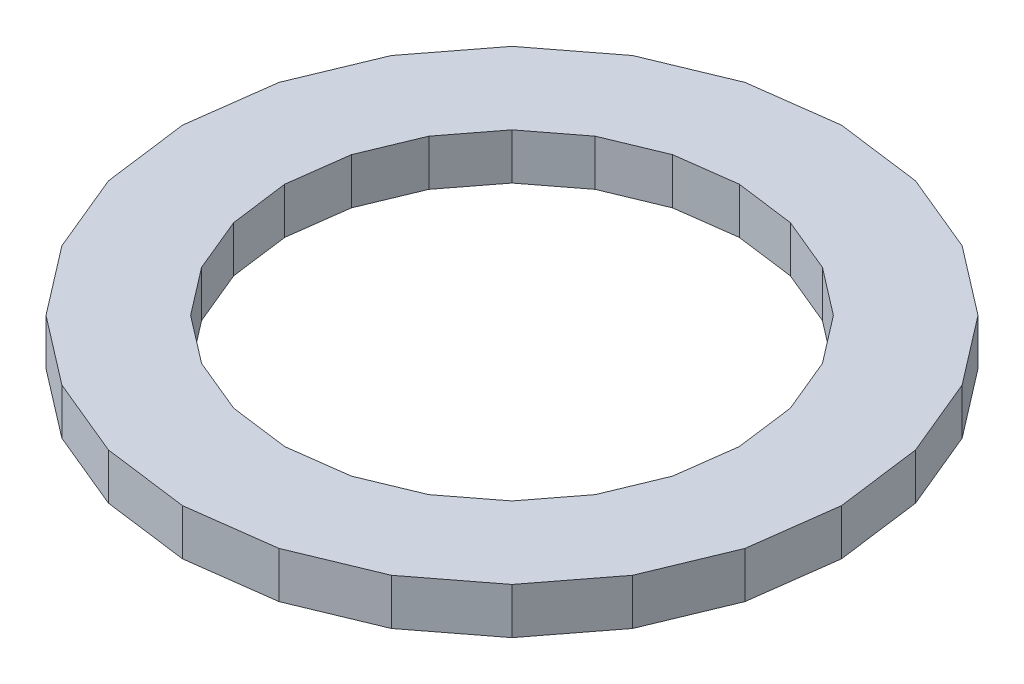
from build123d import *

# Parameters (mm, degrees)
BOSS_EXTRUDE3_DEPTH = 19.05


with BuildPart() as part:
    # Sketch3 → Boss-Extrude3 (new body)
    with BuildSketch(Plane(origin=(0, 0, 0), x_dir=(1, 0, 0), z_dir=(0, 1, 0))):
        Polygon((-136.217870893, 0), (-131.576359498, -35.25577927), (-117.968136643, -68.108935447), (-96.320580227, -96.320580227), (-68.108935447, -117.968136643), (-35.25577927, -131.576359498), (0, -136.217870893), (35.25577927, -131.576359498), (68.108935447, -117.968136643), (96.320580227, -96.320580227), (117.968136643, -68.108935447), (131.576359498, -35.25577927), (136.217870893, 0), (131.576359498, 35.25577927), (117.968136643, 68.108935447), (96.320580227, 96.320580227), (68.108935447, 117.968136643), (35.25577927, 131.576359498), (0, 136.217870893), (-35.25577927, 131.576359498), (-68.108935447, 117.968136643), (-96.320580227, 96.320580227), (-117.968136643, 68.108935447), (-131.576359498, 35.25577927), align=None)
        Polygon((-93.946231155, 0), (-90.745090955, -24.315073839), (-81.35982277, -46.973115578), (-66.430017117, -66.430017117), (-46.973115578, -81.35982277), (-24.315073839, -90.745090955), (0, -93.946231155), (24.315073839, -90.745090955), (46.973115578, -81.35982277), (66.430017117, -66.430017117), (81.35982277, -46.973115578), (90.745090955, -24.315073839), (93.946231155, 0), (90.745090955, 24.315073839), (81.35982277, 46.973115578), (66.430017117, 66.430017117), (46.973115578, 81.35982277), (24.315073839, 90.745090955), (0, 93.946231155), (-24.315073839, 90.745090955), (-46.973115578, 81.35982277), (-66.430017117, 66.430017117), (-81.35982277, 46.973115578), (-90.745090955, 24.315073839), align=None, mode=Mode.SUBTRACT)
    extrude(amount=BOSS_EXTRUDE3_DEPTH)


solid = part.part
